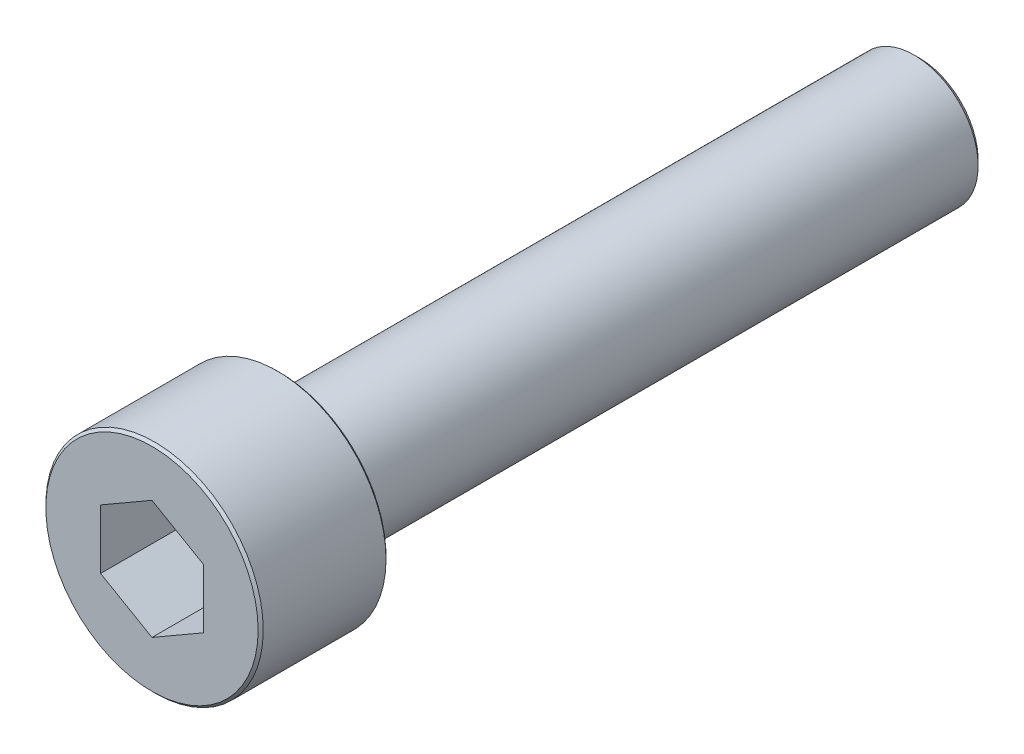
from build123d import *

# Parameters (mm, degrees)
SKETCH_1_W          = 4.25
SKETCH_1_H          = 5
SKETCH_2_R          = 2.5
EXTRUDE_1_DEPTH     = 25
CUT_EXTRUDE_1_DEPTH = 3.75
CHAMFER_1_SIZE2     = 0.100002106
CHAMFER_1_SIZE      = 0.100002056
CHAMFER_2_SIZE      = 0.200033753
CHAMFER_2_SIZE2     = 0.200036689


with BuildPart() as part:
    # 草图1 → 旋转1 (revolve)
    with BuildSketch(Plane(origin=(0, 0, 0), x_dir=(1, 0, 0), z_dir=(0, 1, 0))):
        with Locations((2.125, -27.5)):
            Rectangle(SKETCH_1_W, SKETCH_1_H)
    revolve(axis=Axis((0, 0, 25), (0, 0, 1)))

    # 草图2 → 凸台-拉伸1 (add)
    with BuildSketch(Plane(origin=(0, 0, 25), x_dir=(-1, 0, 0), z_dir=(0, 0, -1))):
        Circle(SKETCH_2_R)
    extrude(amount=EXTRUDE_1_DEPTH)

    # 草图3 → 切除-拉伸1 (cut)
    with BuildSketch(Plane.XY.offset(30)):
        Polygon((-2.01, -1.160474041), (0, -2.320948082), (2.01, -1.160474041), (2.01, 1.160474041), (0, 2.320948082), (-2.01, 1.160474041), align=None)
    extrude(amount=-CUT_EXTRUDE_1_DEPTH, mode=Mode.SUBTRACT)

    # 倒角1
    chamfer_1_edges = [part.edges().sort_by_distance(p)[0] for p in [
        (-4.25, 0, 30),
        (-4.25, 0, 25),
    ]]
    chamfer(chamfer_1_edges, length=CHAMFER_1_SIZE, length2=CHAMFER_1_SIZE2)

    # 倒角2
    chamfer_2_edges = [part.edges().sort_by_distance(p)[0] for p in [
        (2.5, 0, 0),
    ]]
    chamfer_2_side = [part.faces().sort_by_distance(p)[0] for p in [
        (2.5, 0, 12.5),
    ]]
    chamfer(chamfer_2_edges, length=CHAMFER_2_SIZE, length2=CHAMFER_2_SIZE2, reference=chamfer_2_side[0])


solid = part.part
